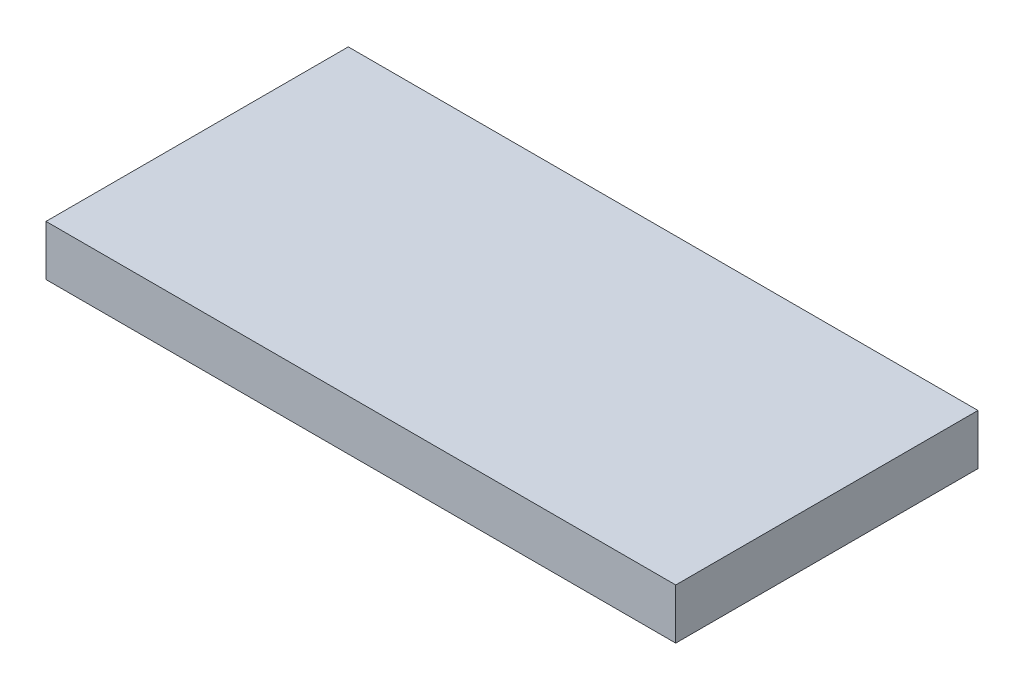
from build123d import *

# Parameters (mm, degrees)
CROQUIS1_W              = 250
CROQUIS1_H              = 120
SALIENTE_EXTRUIR1_DEPTH = 20


with BuildPart() as part:
    # Croquis1 → Saliente-Extruir1 (new body)
    with BuildSketch(Plane(origin=(0, 0, 0), x_dir=(1, 0, 0), z_dir=(0, 1, 0))):
        Rectangle(CROQUIS1_W, CROQUIS1_H)
    extrude(amount=SALIENTE_EXTRUIR1_DEPTH)


solid = part.part
